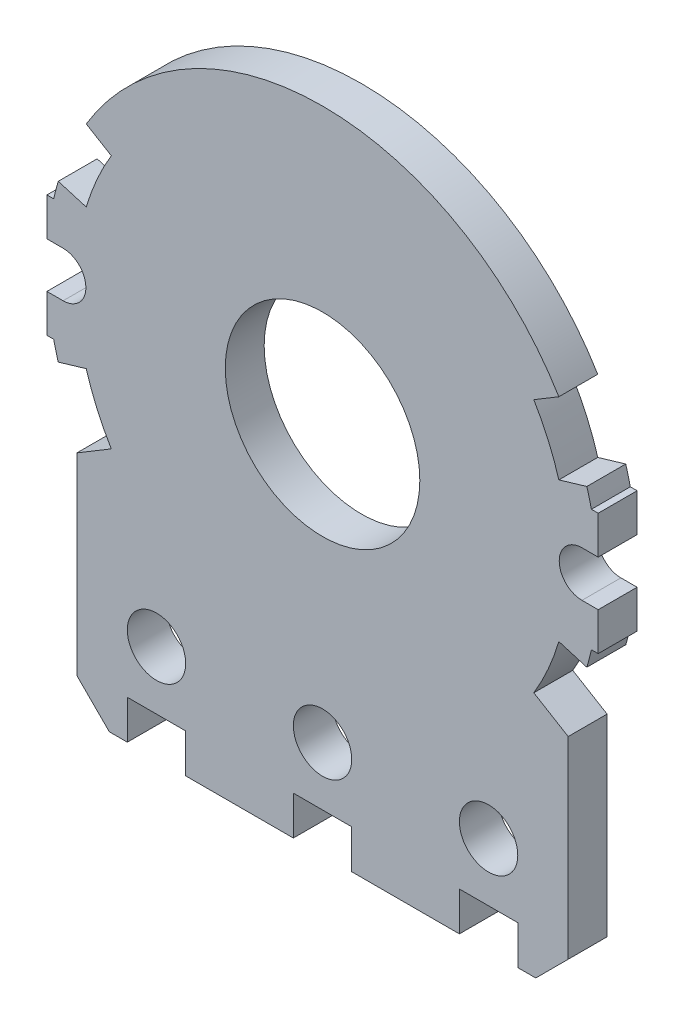
from build123d import *

# Parameters (mm, degrees)
SKETCH1_R           = 3
BOSS_EXTRUDE1_DEPTH = 1.2
SKETCH2_R           = 0.9
SKETCH2_W           = 1.8
SKETCH2_H           = 1.2
CUT_EXTRUDE1_DEPTH  = 15.350609743
CUT_EXTRUDE2_START  = -10
CUT_EXTRUDE2_DEPTH  = 10


with BuildPart() as part:
    # Sketch1 → Boss-Extrude1 (new body)
    with BuildSketch(Plane.XY):
        with BuildLine():
            Line((-7.575, -3.856082857), (-7.575, -11.5))
            Line((-7.575, -11.5), (7.575, -11.5))
            Line((7.575, -11.5), (7.575, -3.856082857))
            ThreePointArc((7.575, -3.856082857), (7.994413326, -2.887794239), (8.290619699, -1.875))
            Line((8.290619699, -1.875), (8.5, -1.875))
            Line((8.5, -1.875), (8.5, 1.875))
            Line((8.5, 1.875), (8.290619699, 1.875))
            ThreePointArc((8.290619699, 1.875), (0, 8.5), (-8.290619699, 1.875))
            Line((-8.290619699, 1.875), (-8.5, 1.875))
            Line((-8.5, 1.875), (-8.5, -1.875))
            Line((-8.5, -1.875), (-8.290619699, -1.875))
            ThreePointArc((-8.290619699, -1.875), (-7.994413326, -2.887794239), (-7.575, -3.856082857))
        make_face()
        Circle(SKETCH1_R, mode=Mode.SUBTRACT)
    extrude(amount=BOSS_EXTRUDE1_DEPTH)

    # Sketch2 → Cut-Extrude1 (cut, through all)
    with BuildSketch(Plane.XY.offset(1.2)):
        with Locations((0, -8.5)):
            Circle(SKETCH2_R)
        with Locations((5.12, -8.5)):
            Circle(SKETCH2_R)
        with Locations(Location((-5.12, -8.5, 0), (0, 0, 180))):
            Circle(SKETCH2_R)
        with Locations((5.12, -10.9)):
            Rectangle(SKETCH2_W, SKETCH2_H)
        with Locations((0, -10.9)):
            Rectangle(SKETCH2_W, SKETCH2_H)
        with Locations((-5.12, -10.9)):
            Rectangle(SKETCH2_W, SKETCH2_H)
        Polygon((7.575, -11.5), (7.575, -10.5), (6.575, -11.5), align=None)
        Polygon((-6.575, -11.5), (-7.575, -11.5), (-7.575, -10.5), align=None)
    extrude(amount=-CUT_EXTRUDE1_DEPTH, mode=Mode.SUBTRACT)

    # Sketch3 → Cut-Extrude2 (cut)
    with BuildSketch(Plane.XY.offset(1.2).offset(CUT_EXTRUDE2_START)):
        with BuildLine():
            ThreePointArc((6.514471485, 3.914289369), (6.956367241, 3.060874843), (7.287029985, 2.15851662))
            Line((7.287029985, 2.15851662), (8.149967746, 2.41413043))
            ThreePointArc((8.149967746, 2.41413043), (7.780147573, 3.423346864), (7.285922056, 4.377823637))
            Line((7.285922056, 4.377823637), (6.514471485, 3.914289369))
        make_face()
        with BuildLine():
            Line((-6.514471485, 3.914289369), (-7.285922056, 4.377823637))
            ThreePointArc((-7.285922056, 4.377823637), (-7.780147573, 3.423346864), (-8.149967746, 2.41413043))
            Line((-8.149967746, 2.41413043), (-7.287029985, 2.15851662))
            ThreePointArc((-7.287029985, 2.15851662), (-6.956367241, 3.060874843), (-6.514471485, 3.914289369))
        make_face()
        with BuildLine():
            Line((8.5, 0.701713619), (8, 0.701713619))
            ThreePointArc((8, 0.701713619), (7.298286381, 0), (8, -0.701713619))
            Line((8, -0.701713619), (8.5, -0.701713619))
            Line((8.5, -0.701713619), (8.5, 0.701713619))
        make_face()
        with BuildLine():
            Line((-8, 0.701713619), (-8.5, 0.701713619))
            Line((-8.5, 0.701713619), (-8.5, -0.701713619))
            Line((-8.5, -0.701713619), (-8, -0.701713619))
            ThreePointArc((-8, -0.701713619), (-7.298286381, 0), (-8, 0.701713619))
        make_face()
        with BuildLine():
            ThreePointArc((7.575, -3.856082857), (7.895470813, -3.148259939), (8.149967746, -2.41413043))
            Line((8.149967746, -2.41413043), (7.287029985, -2.15851662))
            ThreePointArc((7.287029985, -2.15851662), (6.956367241, -3.060874843), (6.514471485, -3.914289369))
            Line((6.514471485, -3.914289369), (7.575, -4.551519189))
            Line((7.575, -4.551519189), (7.575, -3.856082857))
        make_face()
        with BuildLine():
            Line((-7.287029985, -2.15851662), (-8.149967746, -2.41413043))
            ThreePointArc((-8.149967746, -2.41413043), (-7.895470813, -3.148259939), (-7.575, -3.856082857))
            Line((-7.575, -3.856082857), (-7.575, -4.551519189))
            Line((-7.575, -4.551519189), (-6.514471485, -3.914289369))
            ThreePointArc((-6.514471485, -3.914289369), (-6.956367241, -3.060874843), (-7.287029985, -2.15851662))
        make_face()
    extrude(amount=CUT_EXTRUDE2_DEPTH, mode=Mode.SUBTRACT)


solid = part.part
